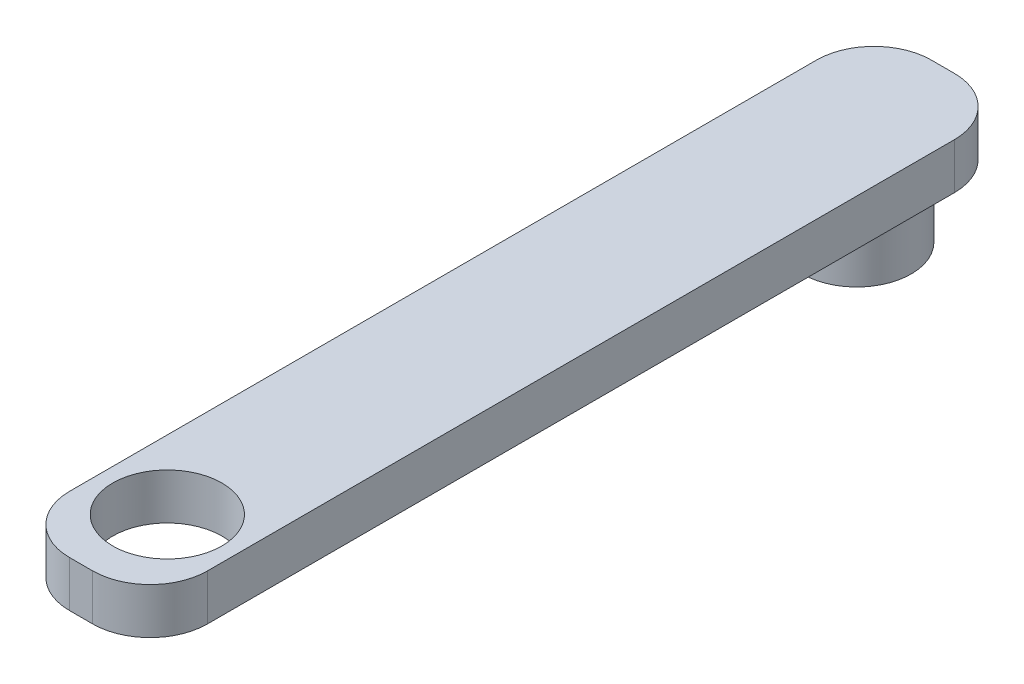
from build123d import *

# Parameters (mm, degrees)
BOSS_EXTRUDE1_DEPTH = 4
SKETCH2_4_R         = 4.75
BOSS_EXTRUDE2_DEPTH = 5.5
SKETCH2_5_R         = 4.75
CUT_EXTRUDE1_DEPTH  = 4


with BuildPart() as part:
    # Sketch2 → Boss-Extrude1 (new body)
    with BuildSketch(Plane(origin=(0, 0, 0), x_dir=(1, 0, 0), z_dir=(0, 1, 0))):
        with BuildLine():
            Line((-1, -37.5), (1, -37.5))
            ThreePointArc((1, -37.5), (4.535533906, -36.035533906), (6, -32.5))
            Line((6, -32.5), (6, 32.5))
            ThreePointArc((6, 32.5), (4.535533906, 36.035533906), (1, 37.5))
            Line((1, 37.5), (-1, 37.5))
            ThreePointArc((-1, 37.5), (-4.535533906, 36.035533906), (-6, 32.5))
            Line((-6, 32.5), (-6, -32.5))
            ThreePointArc((-6, -32.5), (-4.535533906, -36.035533906), (-1, -37.5))
        make_face()
    extrude(amount=BOSS_EXTRUDE1_DEPTH)

    # Sketch2<4> → Boss-Extrude2 (add)
    with BuildSketch(Plane(origin=(0, 0, 0), x_dir=(1, 0, 0), z_dir=(0, 1, 0))):
        with Locations(Location((0, 30, 0), (0, 0, 270))):
            Circle(SKETCH2_4_R)
    extrude(amount=-BOSS_EXTRUDE2_DEPTH)

    # Sketch2<5> → Cut-Extrude1 (cut)
    with BuildSketch(Plane(origin=(0, 0, 0), x_dir=(1, 0, 0), z_dir=(0, 1, 0))):
        with Locations(Location((0, -30, 0), (0, 0, 90))):
            Circle(SKETCH2_5_R)
    extrude(amount=CUT_EXTRUDE1_DEPTH, mode=Mode.SUBTRACT)


solid = part.part
